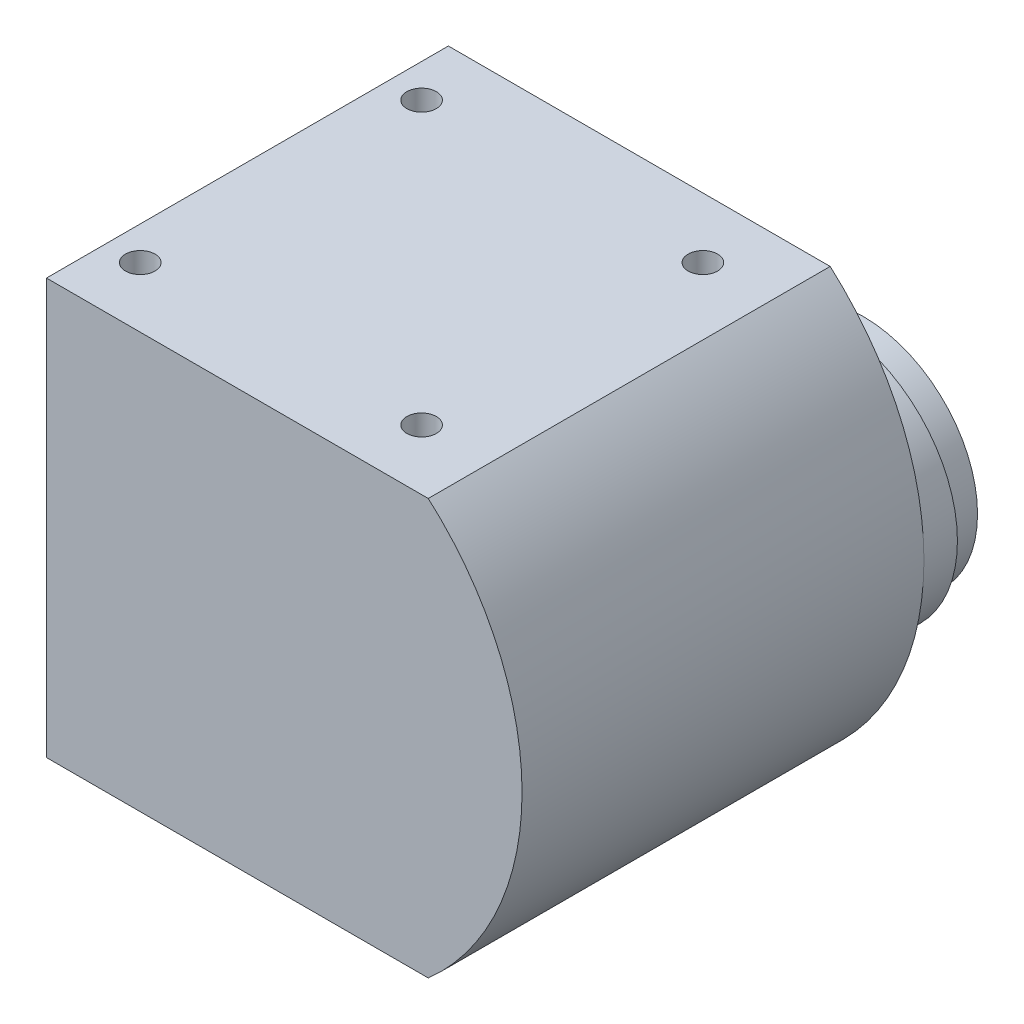
from build123d import *

# Parameters (mm, degrees)
SKETCH_1_R          = 8.5
EXTRUDE_1_DEPTH     = 2.5
SKETCH_2_R          = 9.5
EXTRUDE_2_DEPTH     = 2.5
EXTRUDE_3_DEPTH     = 28
SKETCH_4_W          = 26
SKETCH_4_H          = 26
EXTRUDE_5_DEPTH     = 2
EXTRUDE_6_DEPTH     = 2
SKETCH_7_R          = 1.1
CUT_EXTRUDE_1_DEPTH = 54.4976635


with BuildPart() as part:
    # ｽｹｯﾁ1 → ﾎﾞｽ - 押し出し1 (new body)
    with BuildSketch(Plane.XY):
        Circle(SKETCH_1_R)
    extrude(amount=EXTRUDE_1_DEPTH)

    # ｽｹｯﾁ2 → ﾎﾞｽ - 押し出し2 (add)
    with BuildSketch(Plane.XY.offset(2.5)):
        Circle(SKETCH_2_R)
    extrude(amount=EXTRUDE_2_DEPTH)

    # ｽｹｯﾁ3 → ﾎﾞｽ - 押し出し3 (add)
    with BuildSketch(Plane.XY.offset(5)):
        with BuildLine():
            Line((-26, 15.5), (2.5, 15.5))
            ThreePointArc((2.5, 15.5), (9.5, 0), (2.5, -15.5))
            Line((2.5, -15.5), (-26, -15.5))
            Line((-26, -15.5), (-26, -13))
            Line((-26, -13), (0, -13))
            Line((0, -13), (0, 13))
            Line((0, 13), (-26, 13))
            Line((-26, 13), (-26, 15.5))
        make_face()
    extrude(amount=EXTRUDE_3_DEPTH)

    # ｽｹｯﾁ4 → ﾎﾞｽ - 押し出し5 (add)
    with BuildSketch(Plane(origin=(0, 0, 5), x_dir=(-1, 0, 0), z_dir=(0, 0, -1))):
        with Locations((13, 0)):
            Rectangle(SKETCH_4_W, SKETCH_4_H)
    extrude(amount=-EXTRUDE_5_DEPTH)

    # ｽｹｯﾁ6 → ﾎﾞｽ - 押し出し6 (add)
    with BuildSketch(Plane.XY.offset(33)):
        with BuildLine():
            Line((-26, 15.5), (-26, -15.5))
            Line((-26, -15.5), (2.5, -15.5))
            ThreePointArc((2.5, -15.5), (9.5, 0), (2.5, 15.5))
            Line((2.5, 15.5), (-26, 15.5))
        make_face()
    extrude(amount=EXTRUDE_6_DEPTH)

    # ｽｹｯﾁ7 → ｶｯﾄ - 押し出し1 (cut, through all)
    with BuildSketch(Plane(origin=(0, 15.5, 0), x_dir=(1, 0, 0), z_dir=(0, 1, 0))):
        with Locations(Location((-23.5, -9.5, 0), (0, 0, 180))):
            Circle(SKETCH_7_R)
        with Locations(Location((-2.5, -9.5, 0), (0, 0, 180))):
            Circle(SKETCH_7_R)
        with Locations(Location((-2.5, -30.5, 0), (0, 0, 180))):
            Circle(SKETCH_7_R)
        with Locations(Location((-23.5, -30.5, 0), (0, 0, 180))):
            Circle(SKETCH_7_R)
    extrude(amount=-CUT_EXTRUDE_1_DEPTH, mode=Mode.SUBTRACT)


solid = part.part
